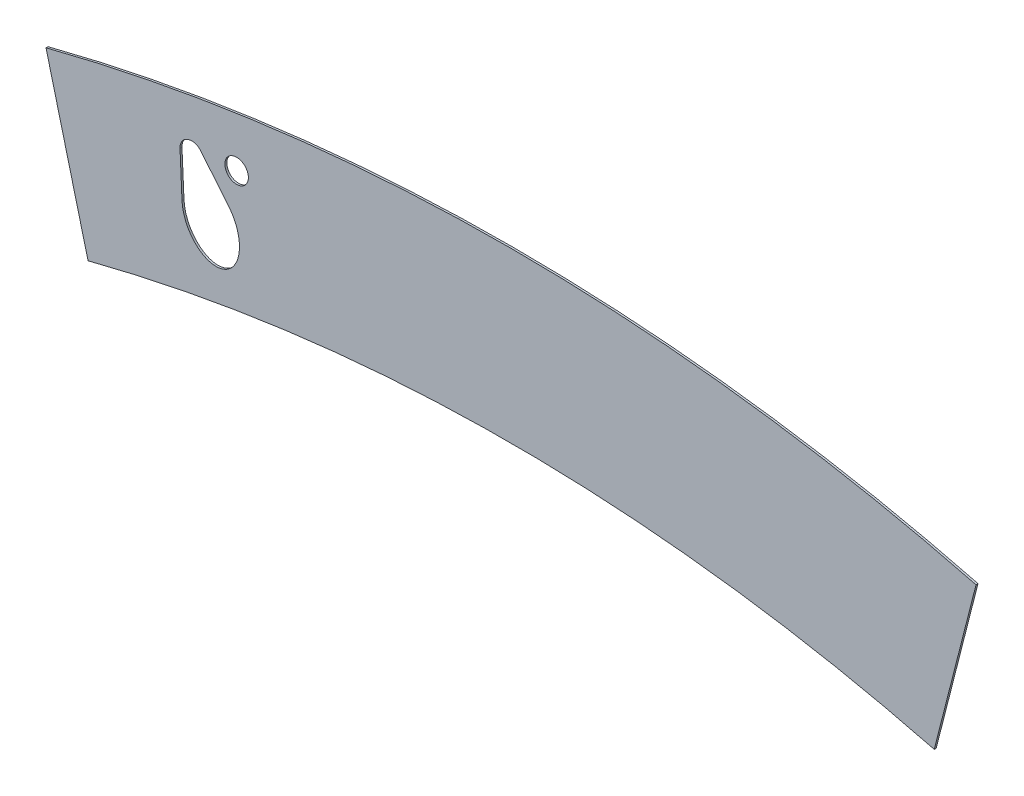
from build123d import *

# Parameters (mm, degrees)
SKETCH1_R          = 19.05
BASE_EXTRUDE_DEPTH = 3.175


with BuildPart() as part:
    # Sketch1 → Base-Extrude (new body)
    with BuildSketch(Plane.XY):
        with BuildLine():
            Line((-752.475, -95.262203185), (-684.4284, -359.69737999))
            ThreePointArc((-684.4284, -359.69737999), (0.19670941, -273.050007044), (684.8094, -359.795448169))
            Line((684.8094, -359.795448169), (752.475, -95.262203185))
            ThreePointArc((752.475, -95.262203185), (0, 0), (-752.475, -95.262203185))
        make_face()
        with Locations((-444.0174, -113.4618)):
            Circle(SKETCH1_R, mode=Mode.SUBTRACT)
        with BuildLine():
            Line((-535.614695533, -127.743373783), (-532.38464705, -199.45456113))
            add(Edge.make_bspline(
                [(-532.38464705, -199.45456113), (-528.480595277, -286.129479355), (-464.930974485, -261.798673459), (-401.381353693, -237.467867563), (-456.359855014, -170.347472288)],
                knots=[4.298855998, 4.298855998, 4.298855998, 6.283185307, 6.283185307, 8.267514616, 8.267514616, 8.267514616], degree=2, weights=[1, 0.546878869, 1, 0.546878869, 1]))
            Line((-456.359855014, -170.347472288), (-501.846758135, -114.814876019))
            ThreePointArc((-501.846758135, -114.814876019), (-523.395377478, -109.095526016), (-535.614695533, -127.743373783))
        make_face(mode=Mode.SUBTRACT)
    extrude(amount=-BASE_EXTRUDE_DEPTH)


solid = part.part
